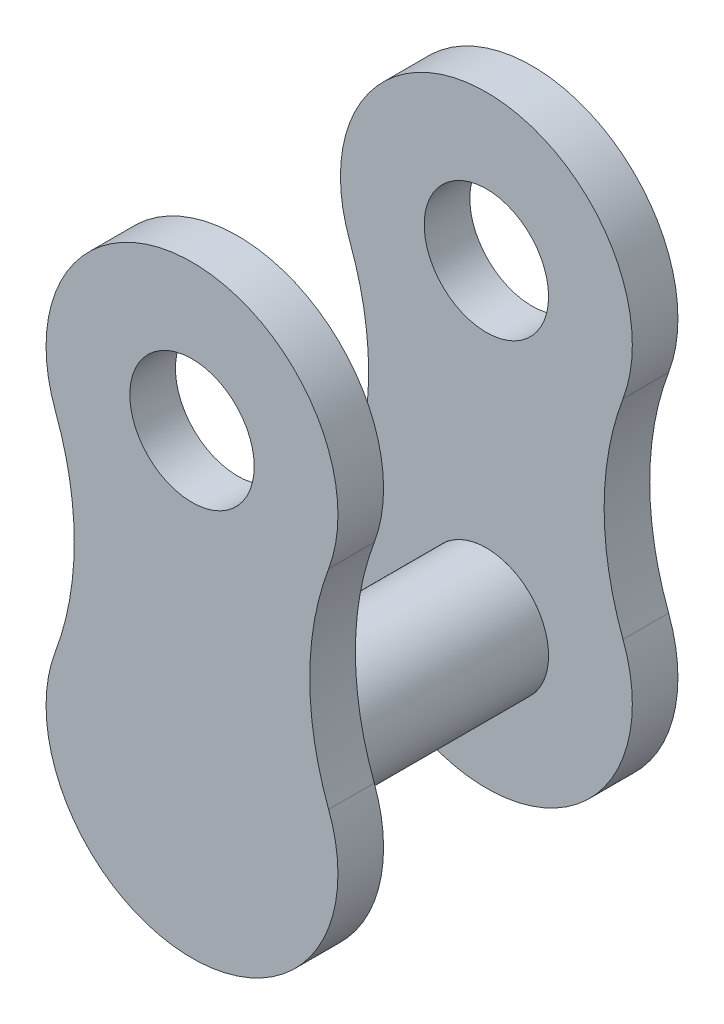
from build123d import *

# Parameters (mm, degrees)
SKETCH2_R           = 4.4704
SKETCH2_R_2         = 1.905
BOSS_EXTRUDE1_DEPTH = 1.397
SKETCH3_R           = 1.905
BOSS_EXTRUDE2_DEPTH = 7.62
SKETCH5_R           = 1.905
BOSS_EXTRUDE4_DEPTH = 1.397


with BuildPart() as part:
    # Sketch2 → Boss-Extrude1 (new body)
    # profile 1 of 3: a face of its own
    with BuildSketch(Plane.XY):
        Circle(SKETCH2_R)
        Circle(SKETCH2_R_2, mode=Mode.SUBTRACT)
    # profile 2 of 3: a face of its own
    with BuildSketch(Plane.XY):
        with BuildLine():
            ThreePointArc((-4.185765955, 1.569662233), (0, 4.4704), (4.185765955, 1.569662233))
            ThreePointArc((4.185765955, 1.569662233), (3.606794054, 4.7625), (4.185765955, 7.955337767))
            ThreePointArc((4.185765955, 7.955337767), (0, 5.0546), (-4.185765955, 7.955337767))
            ThreePointArc((-4.185765955, 7.955337767), (-3.606794054, 4.7625), (-4.185765955, 1.569662233))
        make_face()
    # profile 3 of 3: a face of its own
    with BuildSketch(Plane.XY):
        with Locations((0, 9.525)):
            Circle(SKETCH2_R)
        with Locations((0, 9.525)):
            Circle(SKETCH2_R_2, mode=Mode.SUBTRACT)
    extrude(amount=BOSS_EXTRUDE1_DEPTH)


with BuildPart() as body_2:
    # Sketch3 → Boss-Extrude2 (new body)
    with BuildSketch(Plane.XY.offset(1.397)):
        with Locations(Location((0, 0, 0), (0, 0, 180))):
            Circle(SKETCH3_R)
    extrude(amount=BOSS_EXTRUDE2_DEPTH)

    # Sketch5 → Boss-Extrude4 (add)
    with BuildSketch(Plane.XY.offset(9.017)):
        with BuildLine():
            ThreePointArc((-4.185765955, 1.569662233), (0, -4.4704), (4.185765955, 1.569662233))
            ThreePointArc((4.185765955, 1.569662233), (3.606794054, 4.7625), (4.185765955, 7.955337767))
            ThreePointArc((4.185765955, 7.955337767), (0, 13.9954), (-4.185765955, 7.955337767))
            ThreePointArc((-4.185765955, 7.955337767), (-3.606794054, 4.7625), (-4.185765955, 1.569662233))
        make_face()
        with Locations((0, 9.525)):
            Circle(SKETCH5_R, mode=Mode.SUBTRACT)
    extrude(amount=BOSS_EXTRUDE4_DEPTH)


solid = Compound([part.part, body_2.part])
